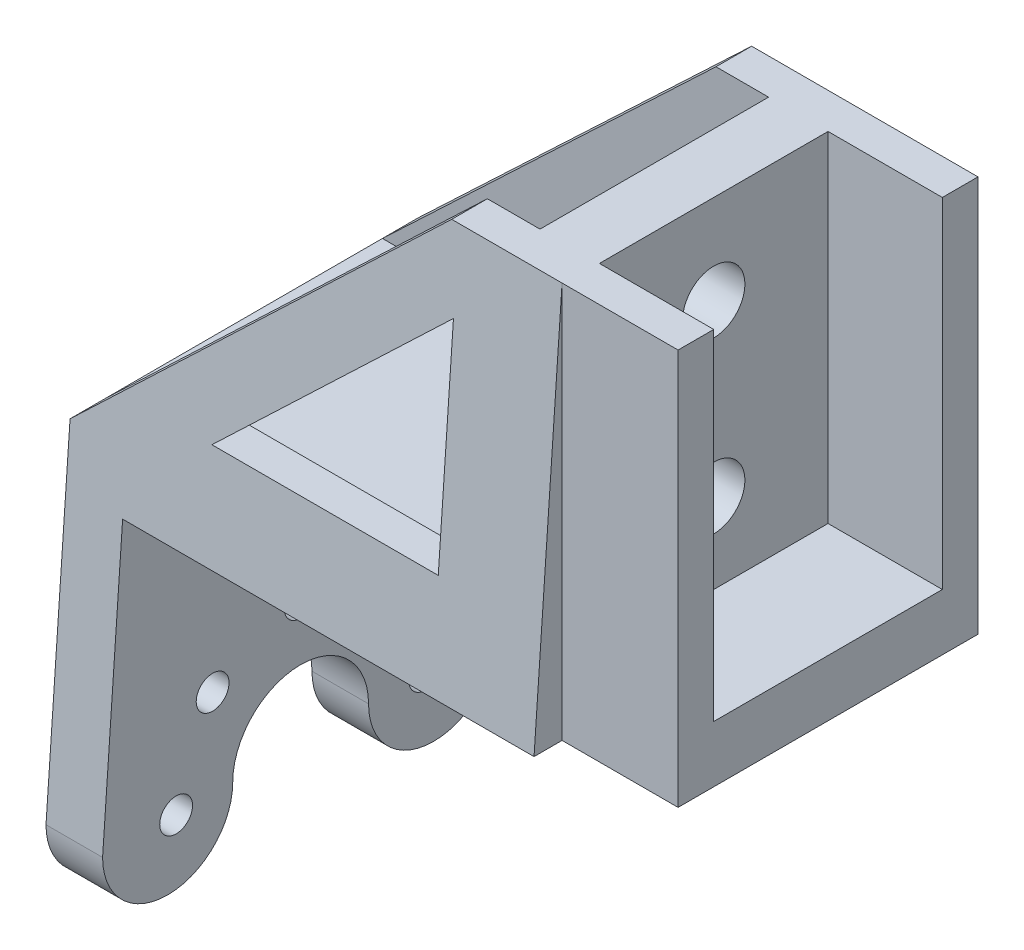
from build123d import *

# Parameters (mm, degrees)
EXTRUDE_1_DEPTH                  = 35
SKETCH_6_R                       = 6
CUT_EXTRUDE_2_DEPTH              = 103.2
SKETCH_7_R                       = 5.75
EXTRUDE_3_DEPTH                  = 103.2
CUT_EXTRUDE_3_REACH              = 88.478
M2_5_CLEARANCE_HOLE1_D           = 2.9
M2_5_CLEARANCE_HOLE1_CSINK_D     = 2.95
M2_5_CLEARANCE_HOLE1_CSINK_ANGLE = 90
SKETCH_16_W                      = 20.2
SKETCH_16_H                      = 20.2
CUT_EXTRUDE_5_DEPTH              = 30
SKETCH_15_W                      = 20.5
SKETCH_15_H                      = 35
CUT_EXTRUDE_6_DEPTH              = 4.25
SKETCH_17_W                      = 20.5
SKETCH_17_H                      = 35
CUT_EXTRUDE_7_DEPTH              = 4.25
CUT_EXTRUDE_8_REACH              = 126.363
CUT_EXTRUDE_9_DEPTH              = 36.25
CUT_EXTRUDE_10_DEPTH             = 36.25
CUT_EXTRUDE_12_DEPTH             = 87.477815158
CUT_EXTRUDE1_START               = -51.6
SKETCH1_W                        = 50
SKETCH1_H                        = 80
CUT_EXTRUDE1_DEPTH               = 51.6
M5_CLEARANCE_HOLE2_D             = 5.5
M5_CLEARANCE_HOLE2_CSINK_D       = 5.55
M5_CLEARANCE_HOLE2_CSINK_ANGLE   = 90


with BuildPart() as part:
    # 草图1 → 凸台-拉伸1 (new body)
    with BuildSketch(Plane.XY):
        Polygon((51.6, -0.076277531), (51.6, 29.923722469), (20, 59.923722469), (-20, 59.923722469), (-51.6, 29.923722469), (-51.6, -0.076277531), align=None)
    extrude(amount=EXTRUDE_1_DEPTH)

    # 草图6 → 切除-拉伸2 (cut)
    with BuildSketch(Plane.ZY.offset(51.6)):
        with Locations((17.5, -0.076277531)):
            Circle(SKETCH_6_R)
    extrude(amount=-CUT_EXTRUDE_2_DEPTH, mode=Mode.SUBTRACT)

    # 草图7 → 凸台-拉伸3 (add)
    with BuildSketch(Plane.ZY.offset(51.6)):
        with Locations((5.75, -0.076277531)):
            Circle(SKETCH_7_R)
        with Locations((29.25, -0.076277531)):
            Circle(SKETCH_7_R)
    extrude(amount=-EXTRUDE_3_DEPTH)

    # 切除-拉伸3: up to this face of the body (flat: up to its plane)
    cut_extrude_3_end = Plane(part.part.faces().sort_by_distance((0, 26.308161829, 0))[0])
    # 草图8 → 切除-拉伸3 (cut, up to the picked face)
    with BuildSketch(Plane.XY.offset(35), mode=Mode.PRIVATE) as cut_extrude_3_sk1:
        Polygon((-46.6, -0.076277531), (-46.6, 24.923722469), (46.6, 24.923722469), (46.6, -0.076277531), (46.6, -12.111349377), (-46.6, -12.111349377), align=None)
    cut_extrude_3_tool1 = split(extrude(cut_extrude_3_sk1.sketch, amount=-CUT_EXTRUDE_3_REACH, mode=Mode.PRIVATE), bisect_by=cut_extrude_3_end, keep=Keep.BOTH, mode=Mode.PRIVATE)
    add(cut_extrude_3_tool1.solids().sort_by(Axis((0, 6.406187, 35), (0, 0, -1)))[0], mode=Mode.SUBTRACT)

    # M2.5 Clearance Hole1 (through all)
    with Locations(Plane(origin=(51.6, 0, 0), x_dir=(0, 0, -1), z_dir=(1, 0, 0))):
        with Locations((-28.5, -0.076277531), (-25.278174593, 7.701897062), (-17.5, 10.923722469), (-9.721825407, 7.701897062), (-6.5, -0.076277531)):
            CounterSinkHole(M2_5_CLEARANCE_HOLE1_D / 2, M2_5_CLEARANCE_HOLE1_CSINK_D / 2, counter_sink_angle=M2_5_CLEARANCE_HOLE1_CSINK_ANGLE)

    # 草图16 → 切除-拉伸5 (cut)
    with BuildSketch(Plane(origin=(0, 59.923722469, 0), x_dir=(1, 0, 0), z_dir=(0, 1, 0))):
        with Locations((0, -17.5)):
            Rectangle(SKETCH_16_W, SKETCH_16_H)
    extrude(amount=-CUT_EXTRUDE_5_DEPTH, mode=Mode.SUBTRACT)

    # 草图15 → 切除-拉伸6 (cut)
    with BuildSketch(Plane.XY.offset(35)):
        with Locations((0, 42.423722469)):
            Rectangle(SKETCH_15_W, SKETCH_15_H)
    extrude(amount=-CUT_EXTRUDE_6_DEPTH, mode=Mode.SUBTRACT)

    # 草图17 → 切除-拉伸7 (cut)
    with BuildSketch(Plane(origin=(0, 0, 0), x_dir=(-1, 0, 0), z_dir=(0, 0, -1))):
        with Locations((0, 42.423722469)):
            Rectangle(SKETCH_17_W, SKETCH_17_H)
    extrude(amount=-CUT_EXTRUDE_7_DEPTH, mode=Mode.SUBTRACT)

    # 切除-拉伸8: up to this face of the body (flat: up to its plane)
    cut_extrude_8_end = Plane(part.part.faces().sort_by_distance((-51.6, 14.183980779, 17.5))[0])
    # 草图20 → 切除-拉伸8 (cut, up to the picked face)
    with BuildSketch(Plane(origin=(51.6, 0, 0), x_dir=(0, 0, -1), z_dir=(1, 0, 0)), mode=Mode.PRIVATE) as cut_extrude_8_sk1:
        Polygon((-30.75, 59.923722469), (-35, 59.923722469), (-35, -0.076277531), align=None)
    cut_extrude_8_tool1 = split(extrude(cut_extrude_8_sk1.sketch, amount=-CUT_EXTRUDE_8_REACH, mode=Mode.PRIVATE), bisect_by=cut_extrude_8_end, keep=Keep.BOTH, mode=Mode.PRIVATE)
    # 草图20 → 切除-拉伸8 (cut, up to the picked face)
    with BuildSketch(Plane(origin=(51.6, 0, 0), x_dir=(0, 0, -1), z_dir=(1, 0, 0)), mode=Mode.PRIVATE) as cut_extrude_8_sk2:
        Polygon((0, -0.076277531), (0, 59.923722469), (-4.25, 59.923722469), align=None)
    cut_extrude_8_tool2 = split(extrude(cut_extrude_8_sk2.sketch, amount=-CUT_EXTRUDE_8_REACH, mode=Mode.PRIVATE), bisect_by=cut_extrude_8_end, keep=Keep.BOTH, mode=Mode.PRIVATE)
    add(cut_extrude_8_tool1.solids().sort_by(Axis((51.6, 39.923722, 33.583333), (-1, 0, 0)))[0], mode=Mode.SUBTRACT)
    add(cut_extrude_8_tool2.solids().sort_by(Axis((51.6, 39.923722, 1.416667), (-1, 0, 0)))[0], mode=Mode.SUBTRACT)

    # 草图21 → 切除-拉伸9 (cut)
    with BuildSketch(Plane(origin=(51.6, 0, 0), x_dir=(0, 0, -1), z_dir=(1, 0, 0))):
        Polygon((-27.6, 59.923722469), (-29.725, 29.923722469), (-5.275, 29.923722469), (-7.4, 59.923722469), align=None)
    extrude(amount=-CUT_EXTRUDE_9_DEPTH, mode=Mode.SUBTRACT)

    # 草图22 → 切除-拉伸10 (cut)
    with BuildSketch(Plane.ZY.offset(51.6)):
        Polygon((29.725, 29.923722469), (27.6, 59.923722469), (7.4, 59.923722469), (5.275, 29.923722469), align=None)
    extrude(amount=-CUT_EXTRUDE_10_DEPTH, mode=Mode.SUBTRACT)

    # 草图25 → 切除-拉伸12 (cut, through all)
    with BuildSketch(Plane.XY):
        Polygon((39.35, 33.923722469), (19.35, 33.923722469), (19.35, 52.911064241), align=None)
        Polygon((-19.35, 52.911064241), (-39.35, 33.923722469), (-19.35, 33.923722469), align=None)
    extrude(amount=CUT_EXTRUDE_12_DEPTH, mode=Mode.SUBTRACT)

    # Sketch1 → Cut-Extrude1 (cut)
    with BuildSketch(Plane(origin=(51.6, 0, 0), x_dir=(0, 0, -1), z_dir=(1, 0, 0)).offset(CUT_EXTRUDE1_START)):
        with Locations((-17.5, 29.923722469)):
            Rectangle(SKETCH1_W, SKETCH1_H)
    extrude(amount=CUT_EXTRUDE1_DEPTH, mode=Mode.SUBTRACT)

    # M5 Clearance Hole2 (through all)
    with Locations(Plane.ZY.offset(15.35)):
        with Locations((17.5, 36.923722469), (17.5, 51.923722469)):
            CounterSinkHole(M5_CLEARANCE_HOLE2_D / 2, M5_CLEARANCE_HOLE2_CSINK_D / 2, counter_sink_angle=M5_CLEARANCE_HOLE2_CSINK_ANGLE)


solid = part.part
